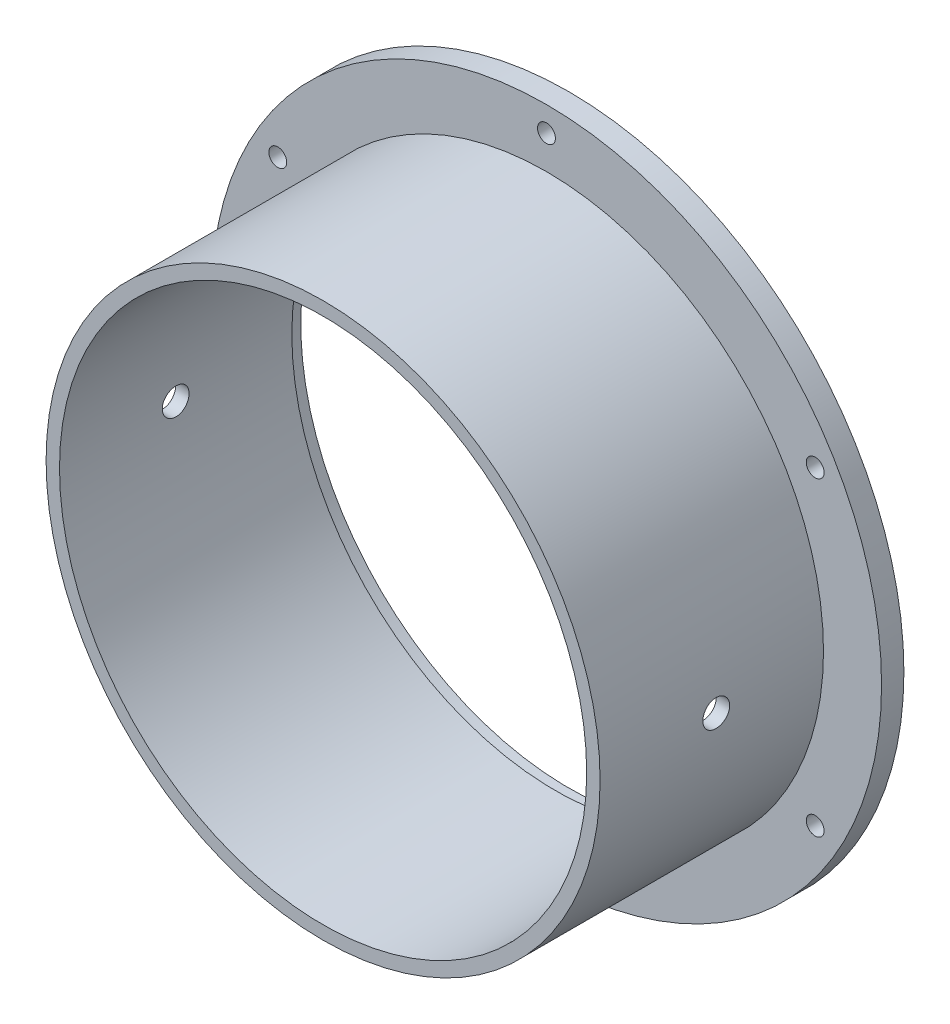
from build123d import *

# Parameters (mm, degrees)
SKETCH_1_R               = 75
SKETCH_1_R_2             = 60
EXTRUDE_1_DEPTH          = 5
EXTRUDE_2_DEPTH          = 50
EXTRUDE_2_DEPTH_BACK     = 2
SKETCH_2_R               = 62
SKETCH_2_R_2             = 59
SKETCH_3_R               = 2
CUT_EXTRUDE_1_DEPTH      = 118.260393996
CUT_EXTRUDE_2_DEPTH      = 120.478031453
CUT_EXTRUDE_2_DEPTH_BACK = 120.478031453
SKETCH_5_R               = 3


with BuildPart() as part:
    # Эскиз1 → Бобышка-Вытянуть1 (new body)
    with BuildSketch(Plane.XY):
        Circle(SKETCH_1_R)
        Circle(SKETCH_1_R_2, mode=Mode.SUBTRACT)
    extrude(amount=EXTRUDE_1_DEPTH)

    # Эскиз3 → Вырез-Вытянуть1 (cut, through all)
    with BuildSketch(Plane.XY.offset(5)):
        with Locations((0, 69.442803579)):
            Circle(SKETCH_3_R)
        with Locations((60.139232009, 34.72140179)):
            Circle(SKETCH_3_R)
        with Locations((60.139232009, -34.72140179)):
            Circle(SKETCH_3_R)
        with Locations((0, -69.442803579)):
            Circle(SKETCH_3_R)
        with Locations((-60.139232009, -34.72140179)):
            Circle(SKETCH_3_R)
        with Locations((-60.139232009, 34.72140179)):
            Circle(SKETCH_3_R)
    extrude(amount=-CUT_EXTRUDE_1_DEPTH, mode=Mode.SUBTRACT)


with BuildPart() as body_2:
    # Эскиз2 → Бобышка-Вытянуть2 (new, two sides: drawn at the far end of the back side and taken through both)
    with BuildSketch(Plane.XY.offset(5).offset(-EXTRUDE_2_DEPTH_BACK)):
        Circle(SKETCH_2_R)
        Circle(SKETCH_2_R_2, mode=Mode.SUBTRACT)
    extrude(amount=EXTRUDE_2_DEPTH + EXTRUDE_2_DEPTH_BACK)

    # Эскиз5 → Вырез-Вытянуть2 (cut, two sides: drawn at the far end of the back side and taken through both)
    with BuildSketch(Plane(origin=(0, 0, 0), x_dir=(0, 0, -1), z_dir=(1, 0, 0)).offset(-CUT_EXTRUDE_2_DEPTH_BACK)):
        with Locations((-29, 0)):
            Circle(SKETCH_5_R)
    extrude(amount=CUT_EXTRUDE_2_DEPTH + CUT_EXTRUDE_2_DEPTH_BACK, mode=Mode.SUBTRACT)


solid = Compound([part.part, body_2.part])
